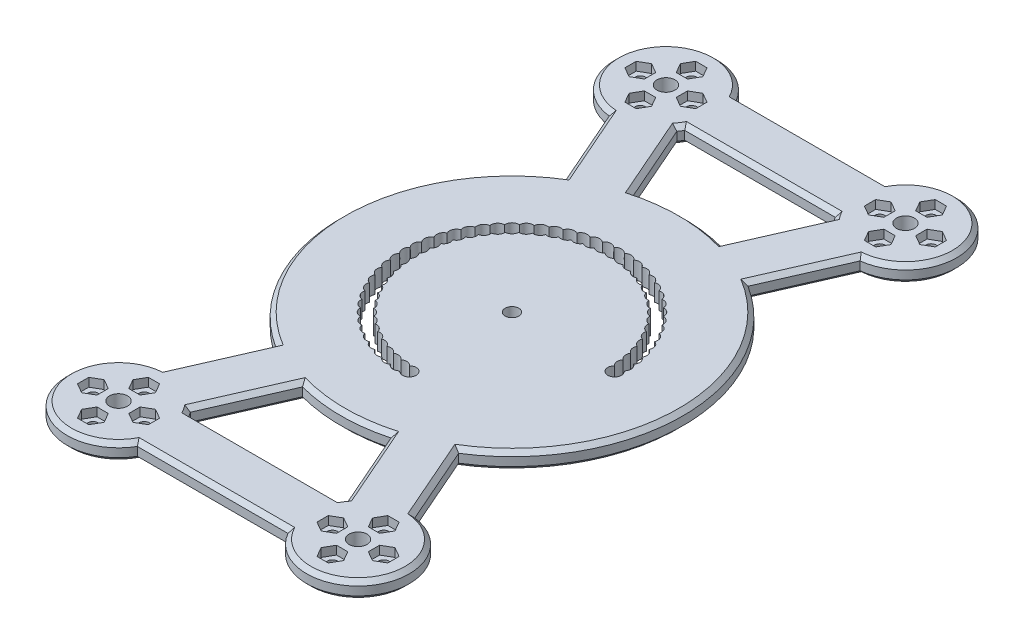
from build123d import *

# Parameters (mm, degrees)
SKETCH1_W           = 100
SKETCH1_H           = 190
BOSS_EXTRUDE1_DEPTH = 5
SKETCH2_R           = 2
CUT_EXTRUDE1_DEPTH  = 108.470926301
SKETCH3_OUTSIDE_W   = 144.954
SKETCH3_OUTSIDE_H   = 234.954
SKETCH3_OUTSIDE_R   = 2.625
SKETCH3_OUTSIDE_R_2 = 1.5
CUT_EXTRUDE2_DEPTH  = 108.470926301
CUT_EXTRUDE3_DEPTH  = 2.5
CHAMFER1_SIZE       = 1.25


with BuildPart() as part:
    # Sketch1 → Boss-Extrude1 (new body)
    with BuildSketch(Plane(origin=(0, 0, 0), x_dir=(1, 0, 0), z_dir=(0, 1, 0))):
        Rectangle(SKETCH1_W, SKETCH1_H)
    extrude(amount=BOSS_EXTRUDE1_DEPTH)

    # Sketch2 → Cut-Extrude1 (cut, through all)
    with BuildSketch(Plane(origin=(0, 5, 0), x_dir=(1, 0, 0), z_dir=(0, 1, 0))):
        with Locations(Location((0, 0, 0), (0, 0, 270))):
            Circle(SKETCH2_R)
        with BuildLine():
            ThreePointArc((28.575471562, 1.403822899), (30.098135349, -1.997590912), (31.280070238, 1.536691311))
            ThreePointArc((31.280070238, 1.536691311), (31.845911254, 3.136548491), (30.978826062, 4.595274757))
            ThreePointArc((30.978826062, 4.595274757), (31.385128973, 6.242890305), (30.379238856, 7.609603194))
            ThreePointArc((30.379238856, 7.609603194), (30.622090743, 9.289109672), (29.487082974, 10.550646993))
            ThreePointArc((29.487082974, 10.550646993), (29.56414504, 12.245869836), (28.310950363, 13.390082294))
            ThreePointArc((28.310950363, 13.390082294), (28.221480459, 15.084695578), (26.862167823, 16.100563782))
            ThreePointArc((26.862167823, 16.100563782), (26.607027594, 17.778247457), (25.154687923, 18.65598804))
            ThreePointArc((25.154687923, 18.65598804), (24.736334508, 20.300585093), (23.204954628, 21.031744934))
            ThreePointArc((23.204954628, 21.031744934), (22.627416998, 22.627416998), (21.031744934, 23.204954628))
            ThreePointArc((21.031744934, 23.204954628), (20.300585093, 24.736334508), (18.65598804, 25.154687923))
            ThreePointArc((18.65598804, 25.154687923), (17.778247457, 26.607027594), (16.100563782, 26.862167823))
            ThreePointArc((16.100563782, 26.862167823), (15.084695578, 28.221480459), (13.390082294, 28.310950363))
            ThreePointArc((13.390082294, 28.310950363), (12.245869836, 29.56414504), (10.550646993, 29.487082974))
            ThreePointArc((10.550646993, 29.487082974), (9.289109672, 30.622090743), (7.609603194, 30.379238856))
            ThreePointArc((7.609603194, 30.379238856), (6.242890305, 31.385128973), (4.595274757, 30.978826062))
            ThreePointArc((4.595274757, 30.978826062), (3.136548491, 31.845911254), (1.536691311, 31.280070238))
            ThreePointArc((1.536691311, 31.280070238), (0, 32), (-1.536691311, 31.280070238))
            ThreePointArc((-1.536691311, 31.280070238), (-3.136548491, 31.845911254), (-4.595274757, 30.978826062))
            ThreePointArc((-4.595274757, 30.978826062), (-6.242890305, 31.385128973), (-7.609603194, 30.379238856))
            ThreePointArc((-7.609603194, 30.379238856), (-9.289109672, 30.622090743), (-10.550646993, 29.487082974))
            ThreePointArc((-10.550646993, 29.487082974), (-12.245869836, 29.56414504), (-13.390082294, 28.310950363))
            ThreePointArc((-13.390082294, 28.310950363), (-15.084695578, 28.221480459), (-16.100563782, 26.862167823))
            ThreePointArc((-16.100563782, 26.862167823), (-17.778247457, 26.607027594), (-18.65598804, 25.154687923))
            ThreePointArc((-18.65598804, 25.154687923), (-20.300585093, 24.736334508), (-21.031744934, 23.204954628))
            ThreePointArc((-21.031744934, 23.204954628), (-22.627416998, 22.627416998), (-23.204954628, 21.031744934))
            ThreePointArc((-23.204954628, 21.031744934), (-24.736334508, 20.300585093), (-25.154687923, 18.65598804))
            ThreePointArc((-25.154687923, 18.65598804), (-26.607027594, 17.778247457), (-26.862167823, 16.100563782))
            ThreePointArc((-26.862167823, 16.100563782), (-28.221480459, 15.084695578), (-28.310950363, 13.390082294))
            ThreePointArc((-28.310950363, 13.390082294), (-29.56414504, 12.245869836), (-29.487082974, 10.550646993))
            ThreePointArc((-29.487082974, 10.550646993), (-30.622090743, 9.289109672), (-30.379238856, 7.609603194))
            ThreePointArc((-30.379238856, 7.609603194), (-31.385128973, 6.242890305), (-30.978826062, 4.595274757))
            ThreePointArc((-30.978826062, 4.595274757), (-31.845911254, 3.136548491), (-31.280070238, 1.536691311))
            ThreePointArc((-31.280070238, 1.536691311), (-32, 0), (-31.280070238, -1.536691311))
            ThreePointArc((-31.280070238, -1.536691311), (-31.845911254, -3.136548491), (-30.978826062, -4.595274757))
            ThreePointArc((-30.978826062, -4.595274757), (-31.385128973, -6.242890305), (-30.379238856, -7.609603194))
            ThreePointArc((-30.379238856, -7.609603194), (-30.622090743, -9.289109672), (-29.487082974, -10.550646993))
            ThreePointArc((-29.487082974, -10.550646993), (-29.56414504, -12.245869836), (-28.310950363, -13.390082294))
            ThreePointArc((-28.310950363, -13.390082294), (-28.221480459, -15.084695578), (-26.862167823, -16.100563782))
            ThreePointArc((-26.862167823, -16.100563782), (-26.607027594, -17.778247457), (-25.154687923, -18.65598804))
            ThreePointArc((-25.154687923, -18.65598804), (-24.736334508, -20.300585093), (-23.204954628, -21.031744934))
            ThreePointArc((-23.204954628, -21.031744934), (-22.627416998, -22.627416998), (-21.031744934, -23.204954628))
            ThreePointArc((-21.031744934, -23.204954628), (-20.300585093, -24.736334508), (-18.65598804, -25.154687923))
            ThreePointArc((-18.65598804, -25.154687923), (-17.778247457, -26.607027594), (-16.100563782, -26.862167823))
            ThreePointArc((-16.100563782, -26.862167823), (-15.084695578, -28.221480459), (-13.390082294, -28.310950363))
            ThreePointArc((-13.390082294, -28.310950363), (-12.245869836, -29.56414504), (-10.550646993, -29.487082974))
            ThreePointArc((-10.550646993, -29.487082974), (-9.289109672, -30.622090743), (-7.609603194, -30.379238856))
            ThreePointArc((-7.609603194, -30.379238856), (-6.242890305, -31.385128973), (-4.595274757, -30.978826062))
            ThreePointArc((-4.595274757, -30.978826062), (-3.136548491, -31.845911254), (-1.536691311, -31.280070238))
            ThreePointArc((-1.536691311, -31.280070238), (1.997590912, -30.098135349), (-1.403822899, -28.575471562))
            ThreePointArc((-1.403822899, -28.575471562), (-2.744479929, -27.865172347), (-4.197949114, -28.30027415))
            ThreePointArc((-4.197949114, -28.30027415), (-5.462529016, -27.461987851), (-6.951646784, -27.752529628))
            ThreePointArc((-6.951646784, -27.752529628), (-8.127970963, -26.794329401), (-9.638396296, -26.937513074))
            ThreePointArc((-9.638396296, -26.937513074), (-10.715136106, -25.86862691), (-12.232322782, -25.863073543))
            ThreePointArc((-12.232322782, -25.863073543), (-13.199108631, -24.693795402), (-14.708445313, -24.539558476))
            ThreePointArc((-14.708445313, -24.539558476), (-15.555966525, -23.281149144), (-17.042917476, -22.979714046))
            ThreePointArc((-17.042917476, -22.979714046), (-17.763011957, -21.644292694), (-19.213257026, -21.198562409))
            ThreePointArc((-19.213257026, -21.198562409), (-19.798989873, -19.798989873), (-21.198562409, -19.213257026))
            ThreePointArc((-21.198562409, -19.213257026), (-21.644292694, -17.763011957), (-22.979714046, -17.042917476))
            ThreePointArc((-22.979714046, -17.042917476), (-23.281149144, -15.555966525), (-24.539558476, -14.708445313))
            ThreePointArc((-24.539558476, -14.708445313), (-24.693795402, -13.199108631), (-25.863073543, -12.232322782))
            ThreePointArc((-25.863073543, -12.232322782), (-25.86862691, -10.715136106), (-26.937513074, -9.638396296))
            ThreePointArc((-26.937513074, -9.638396296), (-26.794329401, -8.127970963), (-27.752529628, -6.951646784))
            ThreePointArc((-27.752529628, -6.951646784), (-27.461987851, -5.462529016), (-28.30027415, -4.197949114))
            ThreePointArc((-28.30027415, -4.197949114), (-27.865172347, -2.744479929), (-28.575471562, -1.403822899))
            ThreePointArc((-28.575471562, -1.403822899), (-28, 0), (-28.575471562, 1.403822899))
            ThreePointArc((-28.575471562, 1.403822899), (-27.865172347, 2.744479929), (-28.30027415, 4.197949114))
            ThreePointArc((-28.30027415, 4.197949114), (-27.461987851, 5.462529016), (-27.752529628, 6.951646784))
            ThreePointArc((-27.752529628, 6.951646784), (-26.794329401, 8.127970963), (-26.937513074, 9.638396296))
            ThreePointArc((-26.937513074, 9.638396296), (-25.86862691, 10.715136106), (-25.863073543, 12.232322782))
            ThreePointArc((-25.863073543, 12.232322782), (-24.693795402, 13.199108631), (-24.539558476, 14.708445313))
            ThreePointArc((-24.539558476, 14.708445313), (-23.281149144, 15.555966525), (-22.979714046, 17.042917476))
            ThreePointArc((-22.979714046, 17.042917476), (-21.644292694, 17.763011957), (-21.198562409, 19.213257026))
            ThreePointArc((-21.198562409, 19.213257026), (-19.798989873, 19.798989873), (-19.213257026, 21.198562409))
            ThreePointArc((-19.213257026, 21.198562409), (-17.763011957, 21.644292694), (-17.042917476, 22.979714046))
            ThreePointArc((-17.042917476, 22.979714046), (-15.555966525, 23.281149144), (-14.708445313, 24.539558476))
            ThreePointArc((-14.708445313, 24.539558476), (-13.199108631, 24.693795402), (-12.232322782, 25.863073543))
            ThreePointArc((-12.232322782, 25.863073543), (-10.715136106, 25.86862691), (-9.638396296, 26.937513074))
            ThreePointArc((-9.638396296, 26.937513074), (-8.127970963, 26.794329401), (-6.951646784, 27.752529628))
            ThreePointArc((-6.951646784, 27.752529628), (-5.462529016, 27.461987851), (-4.197949114, 28.30027415))
            ThreePointArc((-4.197949114, 28.30027415), (-2.744479929, 27.865172347), (-1.403822899, 28.575471562))
            ThreePointArc((-1.403822899, 28.575471562), (0, 28), (1.403822899, 28.575471562))
            ThreePointArc((1.403822899, 28.575471562), (2.744479929, 27.865172347), (4.197949114, 28.30027415))
            ThreePointArc((4.197949114, 28.30027415), (5.462529016, 27.461987851), (6.951646784, 27.752529628))
            ThreePointArc((6.951646784, 27.752529628), (8.127970963, 26.794329401), (9.638396296, 26.937513074))
            ThreePointArc((9.638396296, 26.937513074), (10.715136106, 25.86862691), (12.232322782, 25.863073543))
            ThreePointArc((12.232322782, 25.863073543), (13.199108631, 24.693795402), (14.708445313, 24.539558476))
            ThreePointArc((14.708445313, 24.539558476), (15.555966525, 23.281149144), (17.042917476, 22.979714046))
            ThreePointArc((17.042917476, 22.979714046), (17.763011957, 21.644292694), (19.213257026, 21.198562409))
            ThreePointArc((19.213257026, 21.198562409), (19.798989873, 19.798989873), (21.198562409, 19.213257026))
            ThreePointArc((21.198562409, 19.213257026), (21.644292694, 17.763011957), (22.979714046, 17.042917476))
            ThreePointArc((22.979714046, 17.042917476), (23.281149144, 15.555966525), (24.539558476, 14.708445313))
            ThreePointArc((24.539558476, 14.708445313), (24.693795402, 13.199108631), (25.863073543, 12.232322782))
            ThreePointArc((25.863073543, 12.232322782), (25.86862691, 10.715136106), (26.937513074, 9.638396296))
            ThreePointArc((26.937513074, 9.638396296), (26.794329401, 8.127970963), (27.752529628, 6.951646784))
            ThreePointArc((27.752529628, 6.951646784), (27.461987851, 5.462529016), (28.30027415, 4.197949114))
            ThreePointArc((28.30027415, 4.197949114), (27.865172347, 2.744479929), (28.575471562, 1.403822899))
        make_face()
    extrude(amount=-CUT_EXTRUDE1_DEPTH, mode=Mode.SUBTRACT)

    # Sketch3 outside → Cut-Extrude2 (cut, through all)
    # profile 1 of 23: a face of its own
    with BuildSketch(Plane(origin=(0, 5, 0), x_dir=(1, 0, 0), z_dir=(0, 1, 0))):
        Rectangle(SKETCH3_OUTSIDE_W, SKETCH3_OUTSIDE_H)
        with BuildLine():
            Line((-36.664390623, 65.092625857), (-26.685378431, 42.283455133))
            ThreePointArc((-26.685378431, 42.283455133), (-50, 0), (-26.685378431, -42.283455133))
            Line((-26.685378431, -42.283455133), (-36.664390623, -65.092625857))
            ThreePointArc((-36.664390623, -65.092625857), (-47.553569963, -88.210230275), (-22.009618943, -87.5))
            Line((-22.009618943, -87.5), (22.009618943, -87.5))
            ThreePointArc((22.009618943, -87.5), (47.553569963, -88.210230275), (36.664390623, -65.092625857))
            Line((36.664390623, -65.092625857), (26.685378431, -42.283455133))
            ThreePointArc((26.685378431, -42.283455133), (50, 0), (26.685378431, 42.283455133))
            Line((26.685378431, 42.283455133), (36.664390623, 65.092625857))
            ThreePointArc((36.664390623, 65.092625857), (47.553569963, 88.210230275), (22.009618943, 87.5))
            Line((22.009618943, 87.5), (-22.009618943, 87.5))
            ThreePointArc((-22.009618943, 87.5), (-47.553569963, 88.210230275), (-36.664390623, 65.092625857))
        make_face(mode=Mode.SUBTRACT)
    # profile 2 of 23: a face of its own
    with BuildSketch(Plane(origin=(0, 5, 0), x_dir=(1, 0, 0), z_dir=(0, 1, 0))):
        with Locations(Location((-35, 80, 0), (0, 0, 270))):
            Circle(SKETCH3_OUTSIDE_R)
    # profile 3 of 23: a face of its own
    with BuildSketch(Plane(origin=(0, 5, 0), x_dir=(1, 0, 0), z_dir=(0, 1, 0))):
        with Locations(Location((-35, 87.5, 0), (0, 0, 270))):
            Circle(SKETCH3_OUTSIDE_R_2)
    # profile 4 of 23: a face of its own
    with BuildSketch(Plane(origin=(0, 5, 0), x_dir=(1, 0, 0), z_dir=(0, 1, 0))):
        with Locations(Location((-27.5, 80, 0), (0, 0, 270))):
            Circle(SKETCH3_OUTSIDE_R_2)
    # profile 5 of 23: a face of its own
    with BuildSketch(Plane(origin=(0, 5, 0), x_dir=(1, 0, 0), z_dir=(0, 1, 0))):
        with Locations(Location((-35, 72.5, 0), (0, 0, 270))):
            Circle(SKETCH3_OUTSIDE_R_2)
    # profile 6 of 23: a face of its own
    with BuildSketch(Plane(origin=(0, 5, 0), x_dir=(1, 0, 0), z_dir=(0, 1, 0))):
        with Locations(Location((-42.5, 80, 0), (0, 0, 270))):
            Circle(SKETCH3_OUTSIDE_R_2)
    # profile 7 of 23: a face of its own
    with BuildSketch(Plane(origin=(0, 5, 0), x_dir=(1, 0, 0), z_dir=(0, 1, 0))):
        with Locations(Location((35, 72.5, 0), (0, 0, 90))):
            Circle(SKETCH3_OUTSIDE_R_2)
    # profile 8 of 23: a face of its own
    with BuildSketch(Plane(origin=(0, 5, 0), x_dir=(1, 0, 0), z_dir=(0, 1, 0))):
        with Locations(Location((42.5, 80, 0), (0, 0, 90))):
            Circle(SKETCH3_OUTSIDE_R_2)
    # profile 9 of 23: a face of its own
    with BuildSketch(Plane(origin=(0, 5, 0), x_dir=(1, 0, 0), z_dir=(0, 1, 0))):
        with Locations(Location((27.5, 80, 0), (0, 0, 90))):
            Circle(SKETCH3_OUTSIDE_R_2)
    # profile 10 of 23: a face of its own
    with BuildSketch(Plane(origin=(0, 5, 0), x_dir=(1, 0, 0), z_dir=(0, 1, 0))):
        with Locations(Location((35, 87.5, 0), (0, 0, 90))):
            Circle(SKETCH3_OUTSIDE_R_2)
    # profile 11 of 23: a face of its own
    with BuildSketch(Plane(origin=(0, 5, 0), x_dir=(1, 0, 0), z_dir=(0, 1, 0))):
        with Locations(Location((35, 80, 0), (0, 0, 90))):
            Circle(SKETCH3_OUTSIDE_R)
    # profile 12 of 23: a face of its own
    with BuildSketch(Plane(origin=(0, 5, 0), x_dir=(1, 0, 0), z_dir=(0, 1, 0))):
        with Locations(Location((-35, -72.5, 0), (0, 0, 90))):
            Circle(SKETCH3_OUTSIDE_R_2)
    # profile 13 of 23: a face of its own
    with BuildSketch(Plane(origin=(0, 5, 0), x_dir=(1, 0, 0), z_dir=(0, 1, 0))):
        with Locations(Location((-42.5, -80, 0), (0, 0, 90))):
            Circle(SKETCH3_OUTSIDE_R_2)
    # profile 14 of 23: a face of its own
    with BuildSketch(Plane(origin=(0, 5, 0), x_dir=(1, 0, 0), z_dir=(0, 1, 0))):
        with Locations(Location((-35, -80, 0), (0, 0, 90))):
            Circle(SKETCH3_OUTSIDE_R)
    # profile 15 of 23: a face of its own
    with BuildSketch(Plane(origin=(0, 5, 0), x_dir=(1, 0, 0), z_dir=(0, 1, 0))):
        with Locations(Location((-35, -87.5, 0), (0, 0, 90))):
            Circle(SKETCH3_OUTSIDE_R_2)
    # profile 16 of 23: a face of its own
    with BuildSketch(Plane(origin=(0, 5, 0), x_dir=(1, 0, 0), z_dir=(0, 1, 0))):
        with Locations(Location((-27.5, -80, 0), (0, 0, 90))):
            Circle(SKETCH3_OUTSIDE_R_2)
    # profile 17 of 23: a face of its own
    with BuildSketch(Plane(origin=(0, 5, 0), x_dir=(1, 0, 0), z_dir=(0, 1, 0))):
        with Locations(Location((27.5, -80, 0), (0, 0, 270))):
            Circle(SKETCH3_OUTSIDE_R_2)
    # profile 18 of 23: a face of its own
    with BuildSketch(Plane(origin=(0, 5, 0), x_dir=(1, 0, 0), z_dir=(0, 1, 0))):
        with Locations(Location((35, -87.5, 0), (0, 0, 270))):
            Circle(SKETCH3_OUTSIDE_R_2)
    # profile 19 of 23: a face of its own
    with BuildSketch(Plane(origin=(0, 5, 0), x_dir=(1, 0, 0), z_dir=(0, 1, 0))):
        with Locations(Location((42.5, -80, 0), (0, 0, 270))):
            Circle(SKETCH3_OUTSIDE_R_2)
    # profile 20 of 23: a face of its own
    with BuildSketch(Plane(origin=(0, 5, 0), x_dir=(1, 0, 0), z_dir=(0, 1, 0))):
        with Locations(Location((35, -80, 0), (0, 0, 270))):
            Circle(SKETCH3_OUTSIDE_R)
    # profile 21 of 23: a face of its own
    with BuildSketch(Plane(origin=(0, 5, 0), x_dir=(1, 0, 0), z_dir=(0, 1, 0))):
        with Locations(Location((35, -72.5, 0), (0, 0, 270))):
            Circle(SKETCH3_OUTSIDE_R_2)
    # profile 22 of 23: a face of its own
    with BuildSketch(Plane(origin=(0, 5, 0), x_dir=(1, 0, 0), z_dir=(0, 1, 0))):
        with BuildLine():
            Line((-22.9220306, 71.104908367), (-12.943018408, 48.295737643))
            ThreePointArc((-12.943018408, 48.295737643), (0, 50), (12.943018408, 48.295737643))
            Line((12.943018408, 48.295737643), (22.9220306, 71.104908367))
            ThreePointArc((22.9220306, 71.104908367), (22.446430037, 71.789769725), (22.009618943, 72.5))
            Line((22.009618943, 72.5), (-22.009618943, 72.5))
            ThreePointArc((-22.009618943, 72.5), (-22.446430037, 71.789769725), (-22.9220306, 71.104908367))
        make_face()
    # profile 23 of 23: a face of its own
    with BuildSketch(Plane(origin=(0, 5, 0), x_dir=(1, 0, 0), z_dir=(0, 1, 0))):
        with BuildLine():
            Line((-22.9220306, -71.104908367), (-12.943018408, -48.295737643))
            ThreePointArc((-12.943018408, -48.295737643), (0, -50), (12.943018408, -48.295737643))
            Line((12.943018408, -48.295737643), (22.9220306, -71.104908367))
            ThreePointArc((22.9220306, -71.104908367), (22.446430037, -71.789769725), (22.009618943, -72.5))
            Line((22.009618943, -72.5), (-22.009618943, -72.5))
            ThreePointArc((-22.009618943, -72.5), (-22.446430037, -71.789769725), (-22.9220306, -71.104908367))
        make_face()
    extrude(amount=-CUT_EXTRUDE2_DEPTH, mode=Mode.SUBTRACT)

    # Sketch4 → Cut-Extrude3 (cut)
    with BuildSketch(Plane(origin=(0, 5, 0), x_dir=(1, 0, 0), z_dir=(0, 1, 0))):
        Polygon((-39.65, 81.645448267), (-42.5, 83.290896534), (-45.35, 81.645448267), (-45.35, 78.354551733), (-42.5, 76.709103466), (-39.65, 78.354551733), align=None)
        Polygon((-31.709103466, 72.5), (-33.354551733, 75.35), (-36.645448267, 75.35), (-38.290896534, 72.5), (-36.645448267, 69.65), (-33.354551733, 69.65), align=None)
        Polygon((-24.65, 81.645448267), (-27.5, 83.290896534), (-30.35, 81.645448267), (-30.35, 78.354551733), (-27.5, 76.709103466), (-24.65, 78.354551733), align=None)
        Polygon((-31.709103466, 87.5), (-33.354551733, 90.35), (-36.645448267, 90.35), (-38.290896534, 87.5), (-36.645448267, 84.65), (-33.354551733, 84.65), align=None)
        Polygon((33.354551733, 69.65), (31.709103466, 72.5), (33.354551733, 75.35), (36.645448267, 75.35), (38.290896534, 72.5), (36.645448267, 69.65), align=None)
        Polygon((39.65, 78.354551733), (39.65, 81.645448267), (42.5, 83.290896534), (45.35, 81.645448267), (45.35, 78.354551733), (42.5, 76.709103466), align=None)
        Polygon((33.354551733, 84.65), (31.709103466, 87.5), (33.354551733, 90.35), (36.645448267, 90.35), (38.290896534, 87.5), (36.645448267, 84.65), align=None)
        Polygon((24.65, 78.354551733), (24.65, 81.645448267), (27.5, 83.290896534), (30.35, 81.645448267), (30.35, 78.354551733), (27.5, 76.709103466), align=None)
        Polygon((36.645448267, -84.65), (33.354551733, -84.65), (31.709103466, -87.5), (33.354551733, -90.35), (36.645448267, -90.35), (38.290896534, -87.5), align=None)
        Polygon((42.5, -76.709103466), (39.65, -78.354551733), (39.65, -81.645448267), (42.5, -83.290896534), (45.35, -81.645448267), (45.35, -78.354551733), align=None)
        Polygon((36.645448267, -69.65), (33.354551733, -69.65), (31.709103466, -72.5), (33.354551733, -75.35), (36.645448267, -75.35), (38.290896534, -72.5), align=None)
        Polygon((27.5, -76.709103466), (24.65, -78.354551733), (24.65, -81.645448267), (27.5, -83.290896534), (30.35, -81.645448267), (30.35, -78.354551733), align=None)
        Polygon((-33.354551733, -69.65), (-31.709103466, -72.5), (-33.354551733, -75.35), (-36.645448267, -75.35), (-38.290896534, -72.5), (-36.645448267, -69.65), align=None)
        Polygon((-39.65, -78.354551733), (-39.65, -81.645448267), (-42.5, -83.290896534), (-45.35, -81.645448267), (-45.35, -78.354551733), (-42.5, -76.709103466), align=None)
        Polygon((-33.354551733, -84.65), (-31.709103466, -87.5), (-33.354551733, -90.35), (-36.645448267, -90.35), (-38.290896534, -87.5), (-36.645448267, -84.65), align=None)
        Polygon((-24.65, -78.354551733), (-24.65, -81.645448267), (-27.5, -83.290896534), (-30.35, -81.645448267), (-30.35, -78.354551733), (-27.5, -76.709103466), align=None)
    extrude(amount=-CUT_EXTRUDE3_DEPTH, mode=Mode.SUBTRACT)

    # Chamfer1
    chamfer1_edges = [part.edges().sort_by_distance(p)[0] for p in [
        (-50, 0, 0),
        (-47.553569963, 0, 88.210230275),
        (-47.553569963, 0, -88.210230275),
        (47.553569963, 0, 88.210230275),
        (50, 0, 0),
        (47.553569963, 0, -88.210230275),
        (-22.446430037, 0, 71.789769725),
        (-17.932524504, 0, 59.700323005),
        (0, 0, 50),
        (17.932524504, 0, 59.700323005),
        (22.446430037, 0, 71.789769725),
        (0, 0, 72.5),
        (-22.446430037, 5, 71.789769725),
        (0, 5, 72.5),
        (22.446430037, 5, 71.789769725),
        (17.932524504, 5, 59.700323005),
        (0, 5, 50),
        (-17.932524504, 5, 59.700323005),
        (31.674884527, 0, 53.688040495),
        (31.674884527, 0, -53.688040495),
        (0, 0, -87.5),
        (-31.674884527, 0, -53.688040495),
        (-31.674884527, 0, 53.688040495),
        (0, 0, 87.5),
        (-47.553569963, 5, -88.210230275),
        (47.553569963, 5, -88.210230275),
        (50, 5, 0),
        (47.553569963, 5, 88.210230275),
        (-47.553569963, 5, 88.210230275),
        (-50, 5, 0),
        (0, 5, -87.5),
        (31.674884527, 5, -53.688040495),
        (31.674884527, 5, 53.688040495),
        (0, 5, 87.5),
        (-31.674884527, 5, 53.688040495),
        (-31.674884527, 5, -53.688040495),
        (-22.446430037, 0, -71.789769725),
        (0, 0, -72.5),
        (22.446430037, 0, -71.789769725),
        (17.932524504, 0, -59.700323005),
        (0, 0, -50),
        (-17.932524504, 0, -59.700323005),
        (-22.446430037, 5, -71.789769725),
        (-17.932524504, 5, -59.700323005),
        (0, 5, -50),
        (17.932524504, 5, -59.700323005),
        (22.446430037, 5, -71.789769725),
        (0, 5, -72.5),
    ]]
    chamfer(chamfer1_edges, length=CHAMFER1_SIZE)


solid = part.part
